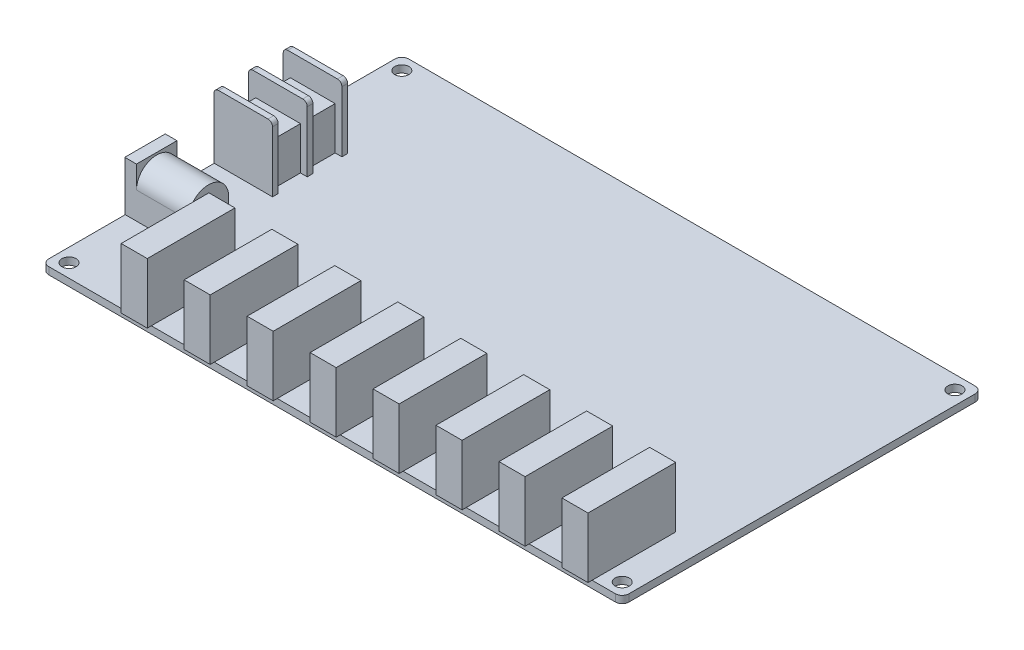
from build123d import *

# Parameters (mm, degrees)
SKETCH_1_W          = 129
SKETCH_1_H          = 80
EXTRUDE_1_DEPTH     = 1.6
SKETCH_2_R          = 1.575
CUT_EXTRUDE_1_DEPTH = 187.325625148
SKETCH_3_W          = 5.8
SKETCH_3_H          = 19.5
EXTRUDE_2_DEPTH     = 13.4
FILLET_1_R          = 1.5
SKETCH_4_W          = 14
SKETCH_4_H          = 9
EXTRUDE_3_DEPTH     = 11
SKETCH_5_W          = 9
SKETCH_5_H          = 11
EXTRUDE_4_DEPTH     = 0.1
CUT_EXTRUDE_2_DEPTH = 11.5
SKETCH_7_R          = 3.2
CUT_EXTRUDE_3_DEPTH = 11.5
SKETCH_8_R          = 0.75
EXTRUDE_5_DEPTH     = 10
EXTRUDE_6_DEPTH     = 14.5
SKETCH_10_W         = 6.45
SKETCH_10_H         = 5
SKETCH_10_W_2       = 6.445
CUT_EXTRUDE_4_DEPTH = 14.5
FILLET_2_R          = 1


with BuildPart() as part:
    # 草图1 → 凸台-拉伸1 (new body)
    with BuildSketch(Plane(origin=(0, 0, 0), x_dir=(1, 0, 0), z_dir=(0, 1, 0))):
        with Locations((103.769660327, 40)):
            Rectangle(SKETCH_1_W, SKETCH_1_H)
    extrude(amount=EXTRUDE_1_DEPTH)

    # 草图2 → 切除-拉伸1 (cut, through all)
    with BuildSketch(Plane(origin=(0, 1.6, 0), x_dir=(1, 0, 0), z_dir=(0, 1, 0))):
        with Locations(Location((42.269660327, 77, 0), (0, 0, 270))):
            Circle(SKETCH_2_R)
        with Locations(Location((42.269660327, 3, 0), (0, 0, 270))):
            Circle(SKETCH_2_R)
        with Locations(Location((165.269660327, 3, 0), (0, 0, 270))):
            Circle(SKETCH_2_R)
        with Locations(Location((165.269660327, 77, 0), (0, 0, 270))):
            Circle(SKETCH_2_R)
    extrude(amount=-CUT_EXTRUDE_1_DEPTH, mode=Mode.SUBTRACT)

    # 草图3 → 凸台-拉伸2 (add)
    with BuildSketch(Plane(origin=(0, 1.6, 0), x_dir=(1, 0, 0), z_dir=(0, 1, 0))):
        with Locations((158.669660327, 8.85)):
            Rectangle(SKETCH_3_W, SKETCH_3_H)
        with Locations((144.669660327, 8.85)):
            Rectangle(SKETCH_3_W, SKETCH_3_H)
        with Locations((130.669660327, 8.85)):
            Rectangle(SKETCH_3_W, SKETCH_3_H)
        with Locations((116.669660327, 8.85)):
            Rectangle(SKETCH_3_W, SKETCH_3_H)
        with Locations((102.669660327, 8.85)):
            Rectangle(SKETCH_3_W, SKETCH_3_H)
        with Locations((88.669660327, 8.85)):
            Rectangle(SKETCH_3_W, SKETCH_3_H)
        with Locations((74.669660327, 8.85)):
            Rectangle(SKETCH_3_W, SKETCH_3_H)
        with Locations((60.669660327, 8.85)):
            Rectangle(SKETCH_3_W, SKETCH_3_H)
    extrude(amount=EXTRUDE_2_DEPTH)

    # 圆角1
    fillet_1_edges = [part.edges().sort_by_distance(p)[0] for p in [
        (168.269660327, 0.8, -80),
        (168.269660327, 0.8, 0),
        (39.269660327, 0.8, 0),
        (39.269660327, 0.8, -80),
    ]]
    fillet(fillet_1_edges, radius=FILLET_1_R)

    # 草图4 → 凸台-拉伸3 (add)
    with BuildSketch(Plane(origin=(0, 1.6, 0), x_dir=(1, 0, 0), z_dir=(0, 1, 0))):
        with Locations((46.269660327, 23)):
            Rectangle(SKETCH_4_W, SKETCH_4_H)
    extrude(amount=EXTRUDE_3_DEPTH)

    # 草图5 → 凸台-拉伸4 (add)
    with BuildSketch(Plane.ZY.offset(-39.269660327)):
        with Locations((-23, 7.1)):
            Rectangle(SKETCH_5_W, SKETCH_5_H)
    extrude(amount=EXTRUDE_4_DEPTH)

    # 草图6 → 切除-拉伸2 (cut)
    with BuildSketch(Plane(origin=(53.269660327, 0, 0), x_dir=(0, 0, -1), z_dir=(1, 0, 0))):
        with BuildLine():
            Line((18.5, 12.6), (18.5, 7.6))
            ThreePointArc((18.5, 7.6), (23, 12.1), (27.5, 7.6))
            Line((27.5, 7.6), (27.5, 12.6))
            Line((27.5, 12.6), (18.5, 12.6))
        make_face()
    extrude(amount=-CUT_EXTRUDE_2_DEPTH, mode=Mode.SUBTRACT)

    # 草图7 → 切除-拉伸3 (cut)
    with BuildSketch(Plane.ZY.offset(-39.169660327)):
        with Locations((-23, 7.6)):
            Circle(SKETCH_7_R)
    extrude(amount=-CUT_EXTRUDE_3_DEPTH, mode=Mode.SUBTRACT)

    # 草图8 → 凸台-拉伸5 (add)
    with BuildSketch(Plane.ZY.offset(-50.669660327)):
        with Locations((-23, 7.6)):
            Circle(SKETCH_8_R)
    extrude(amount=EXTRUDE_5_DEPTH)

    # 草图9 → 凸台-拉伸6 (add)
    with BuildSketch(Plane(origin=(0, 1.6, 0), x_dir=(1, 0, 0), z_dir=(0, 1, 0))):
        Polygon((39.269660327, 38.3), (52.219660327, 38.3), (52.219660327, 39.565), (50.719660327, 39.565), (50.719660327, 46.015), (52.219660327, 46.015), (52.219660327, 47.285), (50.719660327, 47.285), (50.719660327, 53.73), (52.219660327, 53.73), (52.219660327, 55), (39.269660327, 55), (39.169660327, 55), (39.169660327, 53.73), (39.269660327, 53.73), (40.769660327, 53.73), (40.769660327, 47.285), (39.269660327, 47.285), (39.169660327, 47.285), (39.169660327, 46.015), (39.269660327, 46.015), (40.769660327, 46.015), (40.769660327, 39.565), (39.269660327, 39.565), (39.219660327, 39.565), (39.219660327, 38.3), align=None)
    extrude(amount=EXTRUDE_6_DEPTH)

    # 草图10 → 切除-拉伸4 (cut)
    with BuildSketch(Plane.ZY.offset(-39.219660327)):
        with Locations((-42.79, 13.6)):
            Rectangle(SKETCH_10_W, SKETCH_10_H)
        with Locations((-50.5075, 13.6)):
            Rectangle(SKETCH_10_W_2, SKETCH_10_H)
    extrude(amount=-CUT_EXTRUDE_4_DEPTH, mode=Mode.SUBTRACT)

    # 圆角2
    fillet_2_edges = [part.edges().sort_by_distance(p)[0] for p in [
        (39.169660327, 16.1, -46.65),
        (39.219660327, 16.1, -38.9325),
        (52.219660327, 16.1, -38.9325),
        (52.219660327, 16.1, -46.65),
        (52.219660327, 16.1, -54.365),
        (39.169660327, 16.1, -54.365),
    ]]
    fillet(fillet_2_edges, radius=FILLET_2_R)


solid = part.part
